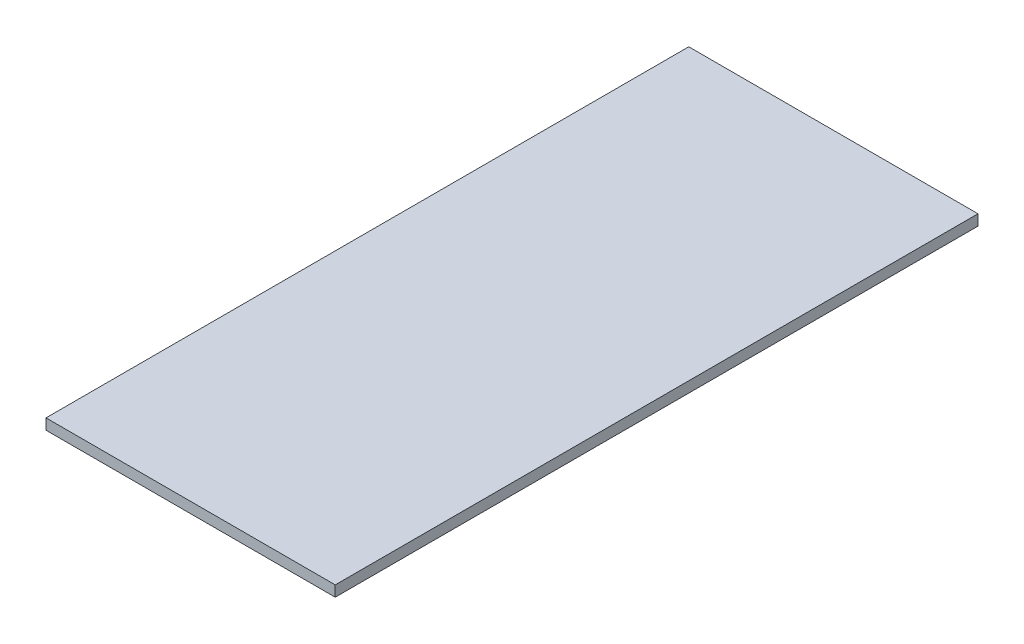
from build123d import *

# Parameters (mm, degrees)
SKETCH1_W           = 85.725
SKETCH1_H           = 190.5
BOSS_EXTRUDE1_DEPTH = 3.175
SHELL1_T            = -1.27
FILLET1_R           = 3.175


with BuildPart() as part:
    # Sketch1 → Boss-Extrude1 (new body)
    with BuildSketch(Plane(origin=(0, 0, 0), x_dir=(1, 0, 0), z_dir=(0, 1, 0))):
        Rectangle(SKETCH1_W, SKETCH1_H)
    extrude(amount=BOSS_EXTRUDE1_DEPTH)

    # Shell1
    shell1_openings = [part.faces().sort_by_distance(p)[0] for p in [
        (0, 0, 0),
    ]]
    offset(amount=SHELL1_T, openings=shell1_openings, kind=Kind.INTERSECTION)

    # Fillet1
    fillet1_edges = [part.edges().sort_by_distance(p)[0] for p in [
        (-41.5925, 0.9525, -93.98),
        (-41.5925, 0.9525, 93.98),
        (41.5925, 0.9525, 93.98),
        (41.5925, 0.9525, -93.98),
    ]]
    fillet(fillet1_edges, radius=FILLET1_R)


solid = part.part
